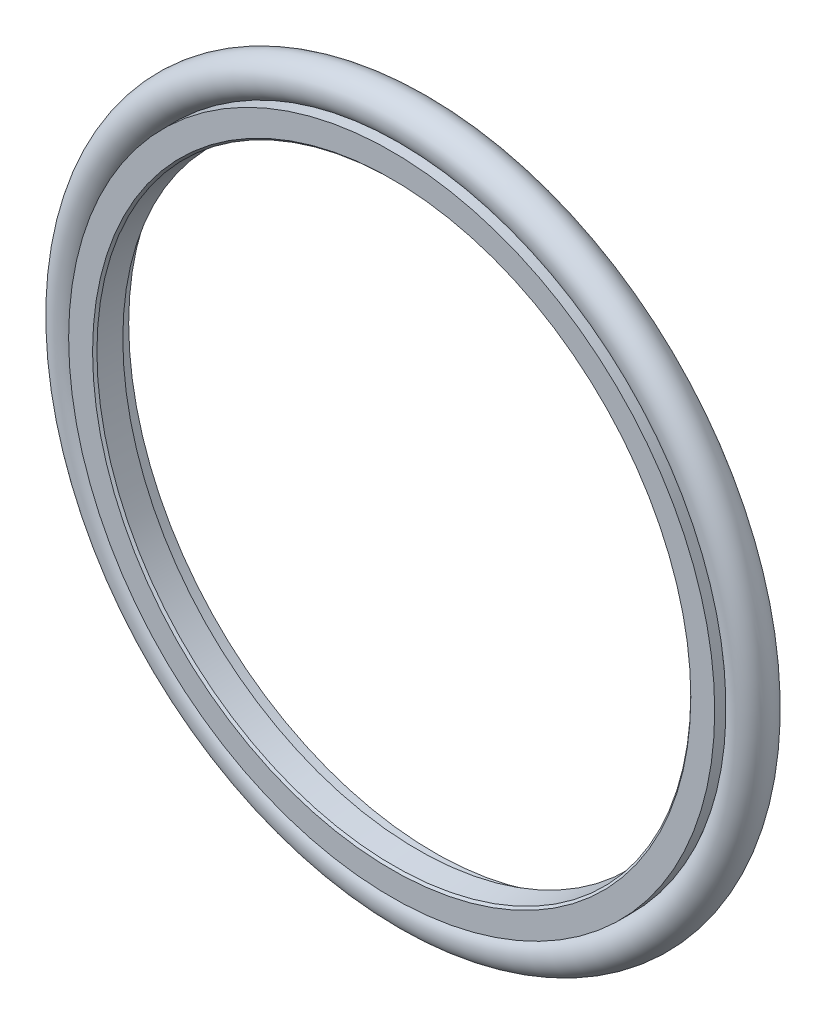
from build123d import *

# Parameters (mm, degrees)
SKETCH4_R = 1.765


with BuildPart() as part:
    # Sketch1 → Revolve1 (revolve)
    with BuildSketch(Plane(origin=(0, 0, 0), x_dir=(0, 0, -1), z_dir=(1, 0, 0))):
        Polygon((0, 28.1), (0, 29.7), (-3.92, 29.7), (-3.92, 27.5), (-3.72, 27.3), (-1.5, 27.14), (-0.9, 28.1), align=None)
    revolve(axis=Axis((0, 0, 0), (0, 0, 1)))


with BuildPart() as body_2:
    # Sketch4 → Revolve2 (revolve)
    with BuildSketch(Plane(origin=(0, 0, 0), x_dir=(0, 0, -1), z_dir=(1, 0, 0))):
        with Locations((-1.96, 31.265)):
            Circle(SKETCH4_R)
    revolve(axis=Axis((0, 0, 0), (0, 0, 1)))


solid = Compound([part.part, body_2.part])
